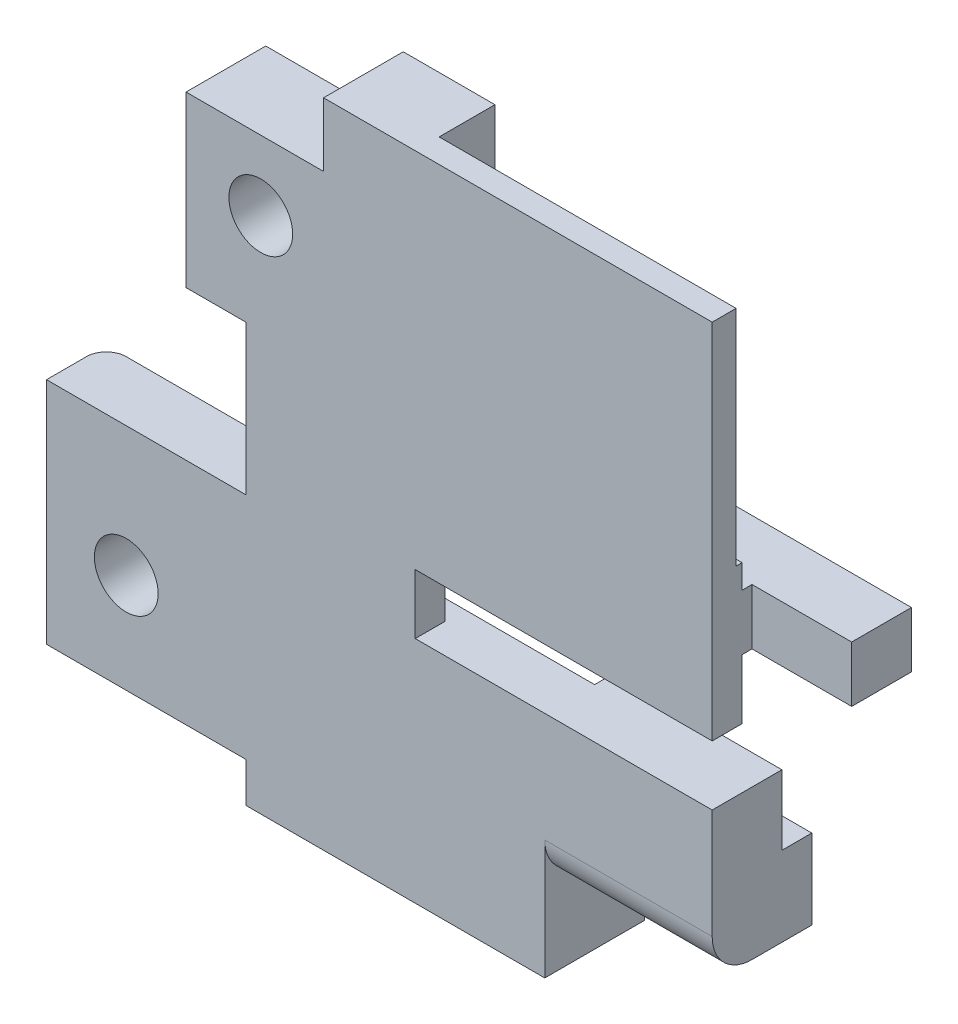
from build123d import *

# Parameters (mm, degrees)
SKETCH_1_W          = 10
SKETCH_1_H          = 11.5
SKETCH_1_R          = 1.6
EXTRUDE_1_DEPTH     = 3
SKETCH_2_W          = 15
SKETCH_2_H          = 6
EXTRUDE_2_DEPTH     = 5
FILLET_1_R          = 1
SKETCH_3_W          = 5
SKETCH_3_H          = 5
EXTRUDE_3_DEPTH     = 2
SKETCH_4_W          = 5
SKETCH_4_H          = 3
EXTRUDE_4_DEPTH     = 19.5
SKETCH_5_W          = 5
SKETCH_5_H          = 3.5
EXTRUDE_5_DEPTH     = 3
SKETCH_6_W          = 3
SKETCH_6_H          = 8.5
EXTRUDE_6_DEPTH     = 3
EXTRUDE_7_DEPTH     = 1
SKETCH_8_W          = 3.5
SKETCH_8_H          = 21.5
EXTRUDE_8_DEPTH     = 1
SKETCH_9_W          = 3
SKETCH_9_H          = 8
EXTRUDE_9_DEPTH     = 3.5
EXTRUDE_10_REACH    = 29.208
SKETCH_10_W         = 2.5
SKETCH_10_H         = 3.5
EXTRUDE_11_REACH    = 29.208
SKETCH_11_W         = 3
SKETCH_11_H         = 4
SKETCH_12_W         = 1.5
SKETCH_12_H         = 1.2
CUT_EXTRUDE_1_DEPTH = 2
SKETCH_13_W         = 1
SKETCH_13_H         = 2.5
EXTRUDE_12_DEPTH    = 6.5
SKETCH_14_W         = 1.2
SKETCH_14_H         = 8
EXTRUDE_13_DEPTH    = 6.5
SKETCH_15_W         = 4
SKETCH_15_H         = 4
EXTRUDE_14_DEPTH    = 2.8
FILLET_2_R          = 1
CUT_EXTRUDE_2_REACH = 33.357
SKETCH_16_R         = 1.6
SKETCH_17_W         = 15
SKETCH_17_H         = 5
EXTRUDE_15_DEPTH    = 2
EXTRUDE_16_DEPTH    = 5.5
SKETCH_19_W         = 2
SKETCH_19_H         = 2.8
EXTRUDE_17_DEPTH    = 2
EXTRUDE_18_DEPTH    = 5.5
EXTRUDE_19_DEPTH    = 2.9
EXTRUDE_20_DEPTH    = 0.5
FILLET_3_R          = 2
SKETCH_23_W         = 14.9
SKETCH_23_H         = 1.5
EXTRUDE_21_DEPTH    = 0.5
SKETCH_24_W         = 3
SKETCH_24_H         = 2.8
EXTRUDE_22_DEPTH    = 5
EXTRUDE_23_DEPTH    = 3.2


with BuildPart() as part:
    # 草图1 → 凸台-拉伸1 (new body)
    with BuildSketch(Plane.XY):
        with Locations((1, 0.75)):
            Rectangle(SKETCH_1_W, SKETCH_1_H)
        Circle(SKETCH_1_R, mode=Mode.SUBTRACT)
    extrude(amount=EXTRUDE_1_DEPTH)

    # 草图2 → 凸台-拉伸2 (add)
    with BuildSketch(Plane.XY.offset(3)):
        with Locations((13.5, -2)):
            Rectangle(SKETCH_2_W, SKETCH_2_H)
    extrude(amount=-EXTRUDE_2_DEPTH)

    # 圆角1
    fillet_1_edges = [part.edges().sort_by_distance(p)[0] for p in [
        (-4, 0.75, 0),
    ]]
    fillet(fillet_1_edges, radius=FILLET_1_R)

    # 草图3 → 凸台-拉伸3 (add)
    with BuildSketch(Plane(origin=(0, 1, 0), x_dir=(1, 0, 0), z_dir=(0, 1, 0))):
        with Locations((8.5, -0.5)):
            Rectangle(SKETCH_3_W, SKETCH_3_H)
    extrude(amount=EXTRUDE_3_DEPTH)

    # 草图4 → 凸台-拉伸4 (add)
    with BuildSketch(Plane(origin=(0, 3, 0), x_dir=(1, 0, 0), z_dir=(0, 1, 0))):
        with Locations((8.5, -1.5)):
            Rectangle(SKETCH_4_W, SKETCH_4_H)
    extrude(amount=EXTRUDE_4_DEPTH)

    # 草图5 → 凸台-拉伸5 (add)
    with BuildSketch(Plane(origin=(0, 0, 0), x_dir=(-1, 0, 0), z_dir=(0, 0, -1))):
        with Locations((-8.5, 11.75)):
            Rectangle(SKETCH_5_W, SKETCH_5_H)
    extrude(amount=EXTRUDE_5_DEPTH)

    # 草图6 → 凸台-拉伸6 (add)
    with BuildSketch(Plane.ZY.offset(-6)):
        with Locations((1.5, 18.25)):
            Rectangle(SKETCH_6_W, SKETCH_6_H)
    extrude(amount=EXTRUDE_6_DEPTH)

    # 草图7 → 凸台-拉伸7 (add)
    with BuildSketch(Plane(origin=(0, 0, 0), x_dir=(-1, 0, 0), z_dir=(0, 0, -1))):
        Polygon((-11, 13.5), (-6, 13.5), (-6, 14), (-3, 14), (-3, 22.5), (-11, 22.5), align=None)
    extrude(amount=EXTRUDE_7_DEPTH)

    # 草图8 → 凸台-拉伸8 (add)
    with BuildSketch(Plane.XY.offset(3)):
        with Locations((12.75, 11.75)):
            Rectangle(SKETCH_8_W, SKETCH_8_H)
    extrude(amount=-EXTRUDE_8_DEPTH)

    # 草图9 → 凸台-拉伸9 (add)
    with BuildSketch(Plane(origin=(11, 0, 0), x_dir=(0, 0, -1), z_dir=(1, 0, 0))):
        with Locations((-0.5, 18.5)):
            Rectangle(SKETCH_9_W, SKETCH_9_H)
    extrude(amount=EXTRUDE_9_DEPTH)

    # 凸台-拉伸10: up to this face of the body (flat: up to its plane)
    extrude_10_end = Plane(part.part.faces().sort_by_distance((21, -2, 0.5))[0])
    # 草图10 → 凸台-拉伸10 (add, up to the picked face)
    with BuildSketch(Plane(origin=(11, 0, 0), x_dir=(0, 0, -1), z_dir=(1, 0, 0)), mode=Mode.PRIVATE) as extrude_10_sk1:
        with Locations((-1.75, 2.75)):
            Rectangle(SKETCH_10_W, SKETCH_10_H)
    extrude_10_tool1 = split(extrude(extrude_10_sk1.sketch, amount=EXTRUDE_10_REACH, mode=Mode.PRIVATE), bisect_by=extrude_10_end, keep=Keep.BOTH, mode=Mode.PRIVATE)
    add(extrude_10_tool1.solids().sort_by(Axis((11, 2.75, 1.75), (1, 0, 0)))[0])

    # 凸台-拉伸11: up to this face of the body (flat: up to its plane)
    extrude_11_end = Plane(part.part.faces().sort_by_distance((21, -0.927419355, 0.782258065))[0])
    # 草图11 → 凸台-拉伸11 (add, up to the picked face)
    with BuildSketch(Plane(origin=(11, 0, 0), x_dir=(0, 0, -1), z_dir=(1, 0, 0)), mode=Mode.PRIVATE) as extrude_11_sk1:
        with Locations((-1.5, 12.5)):
            Rectangle(SKETCH_11_W, SKETCH_11_H)
    extrude_11_tool1 = split(extrude(extrude_11_sk1.sketch, amount=EXTRUDE_11_REACH, mode=Mode.PRIVATE), bisect_by=extrude_11_end, keep=Keep.BOTH, mode=Mode.PRIVATE)
    add(extrude_11_tool1.solids().sort_by(Axis((11, 12.5, 1.5), (1, 0, 0)))[0])

    # 草图12 → 切除-拉伸1 (cut)
    with BuildSketch(Plane(origin=(21, 0, 0), x_dir=(0, 0, -1), z_dir=(1, 0, 0))):
        with Locations((-0.75, 13.9)):
            Rectangle(SKETCH_12_W, SKETCH_12_H)
    extrude(amount=-CUT_EXTRUDE_1_DEPTH, mode=Mode.SUBTRACT)

    # 草图13 → 凸台-拉伸12 (add)
    with BuildSketch(Plane(origin=(14.5, 0, 0), x_dir=(0, 0, -1), z_dir=(1, 0, 0))):
        with Locations((-2.5, 9.25)):
            Rectangle(SKETCH_13_W, SKETCH_13_H)
    extrude(amount=EXTRUDE_12_DEPTH)

    # 草图14 → 凸台-拉伸13 (add)
    with BuildSketch(Plane(origin=(14.5, 0, 0), x_dir=(0, 0, -1), z_dir=(1, 0, 0))):
        with Locations((-2.4, 18.5)):
            Rectangle(SKETCH_14_W, SKETCH_14_H)
    extrude(amount=EXTRUDE_13_DEPTH)

    # 草图15 → 凸台-拉伸14 (add)
    with BuildSketch(Plane(origin=(0, 0, 1.8), x_dir=(-1, 0, 0), z_dir=(0, 0, -1))):
        with Locations((-16.5, 16.5)):
            Rectangle(SKETCH_15_W, SKETCH_15_H)
    extrude(amount=EXTRUDE_14_DEPTH)

    # 圆角2
    fillet_2_edges = [part.edges().sort_by_distance(p)[0] for p in [
        (14.5, 18.5, 0.4),
    ]]
    fillet(fillet_2_edges, radius=FILLET_2_R)

    # 草图16 → 切除-拉伸2 (cut, up to next)
    with BuildSketch(Plane.XY.offset(3), mode=Mode.PRIVATE) as cut_extrude_2_sk1:
        with Locations((6.75, 19)):
            Circle(SKETCH_16_R)
    cut_extrude_2_tool1 = extrude(cut_extrude_2_sk1.sketch, amount=-CUT_EXTRUDE_2_REACH, mode=Mode.PRIVATE) & part.part
    add(cut_extrude_2_tool1.solids().sort_by_distance((6.75, 19, 3))[0], mode=Mode.SUBTRACT)

    # 草图17 → 凸台-拉伸15 (add)
    with BuildSketch(Plane.XZ.offset(5)):
        with Locations((13.5, 0.5)):
            Rectangle(SKETCH_17_W, SKETCH_17_H)
    extrude(amount=EXTRUDE_15_DEPTH)

    # 草图18 → 凸台-拉伸16 (add)
    with BuildSketch(Plane(origin=(21, 0, 0), x_dir=(0, 0, -1), z_dir=(1, 0, 0))):
        Polygon((0, 13.3), (-1.5, 13.3), (-1.5, 14.5), (-1.8, 14.5), (-1.8, 22.5), (-3, 22.5), (-3, 8), (-2, 8), (-2, 10.5), (0, 10.5), align=None)
    extrude(amount=EXTRUDE_16_DEPTH)

    # 草图19 → 凸台-拉伸17 (add)
    with BuildSketch(Plane(origin=(0, 0, 0), x_dir=(-1, 0, 0), z_dir=(0, 0, -1))):
        with Locations((-25.5, 11.9)):
            Rectangle(SKETCH_19_W, SKETCH_19_H)
    extrude(amount=EXTRUDE_17_DEPTH)

    # 草图20 → 凸台-拉伸18 (add)
    with BuildSketch(Plane(origin=(21, 0, 0), x_dir=(0, 0, -1), z_dir=(1, 0, 0))):
        Polygon((0.5, -3), (-3, -3), (-3, 4.5), (0.5, 4.5), (0.5, 1), (2, 1), (2, -3), align=None)
    extrude(amount=EXTRUDE_18_DEPTH)

    # 草图21 → 凸台-拉伸19 (add)
    with BuildSketch(Plane(origin=(26.5, 0, 0), x_dir=(0, 0, -1), z_dir=(1, 0, 0))):
        Polygon((-3, -3), (2, -3), (2, 1), (0.5, 1), (0.5, 4.5), (-3, 4.5), align=None)
        Polygon((-2, 10.5), (2, 10.5), (2, 13.3), (-1.5, 13.3), (-1.5, 14.5), (-1.8, 14.5), (-1.8, 22.5), (-3, 22.5), (-3, 8), (-2, 8), align=None)
    extrude(amount=EXTRUDE_19_DEPTH)

    # 草图22 → 凸台-拉伸20 (add)
    with BuildSketch(Plane(origin=(0, 0, 2), x_dir=(-1, 0, 0), z_dir=(0, 0, -1))):
        Polygon((-11, 10.5), (-29.4, 10.5), (-29.4, 8), (-14.5, 8), (-14.5, 4.5), (-11, 4.5), align=None)
    extrude(amount=EXTRUDE_20_DEPTH)

    # 圆角3
    fillet_3_edges = [part.edges().sort_by_distance(p)[0] for p in [
        (25.2, -3, 3),
    ]]
    fillet(fillet_3_edges, radius=FILLET_3_R)

    # 草图23 → 凸台-拉伸21 (add)
    with BuildSketch(Plane.XZ.offset(-8)):
        with Locations((21.95, 2.25)):
            Rectangle(SKETCH_23_W, SKETCH_23_H)
    extrude(amount=EXTRUDE_21_DEPTH)

    # 草图24 → 凸台-拉伸22 (add)
    with BuildSketch(Plane(origin=(29.4, 0, 0), x_dir=(0, 0, -1), z_dir=(1, 0, 0))):
        with Locations((0.5, 11.9)):
            Rectangle(SKETCH_24_W, SKETCH_24_H)
    extrude(amount=EXTRUDE_22_DEPTH)

    # 草图25 → 凸台-拉伸23 (add)
    with BuildSketch(Plane(origin=(0, 22.5, 0), x_dir=(1, 0, 0), z_dir=(0, 1, 0))):
        Polygon((9.9, 1), (9.9, -3), (29.4, -3), (29.4, -1.8), (14.5, -1.8), (14.5, 1), align=None)
    extrude(amount=EXTRUDE_23_DEPTH)


solid = part.part
